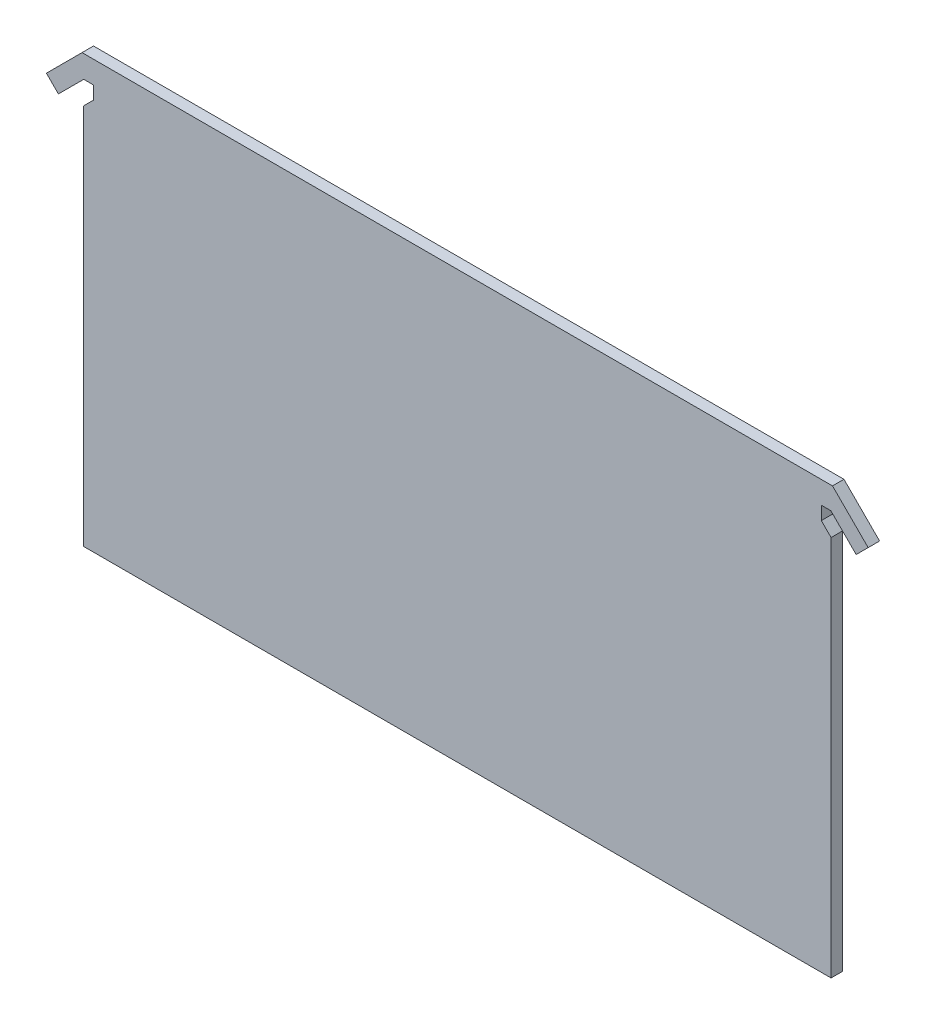
from build123d import *

# Parameters (mm, degrees)
BOSS_EXTRUDE1_DEPTH = 6


with BuildPart() as part:
    # Sketch1 → Boss-Extrude1 (new body)
    with BuildSketch(Plane.XY):
        Polygon((163.741243393, 121.016675198), (-153.702428255, 121.016675198), (-191.706323206, 121.016675198), (-210.391169282, 102.331829122), (-204.103303895, 96.043963734), (-190.830592431, 109.316675198), (-185.830592431, 109.316675198), (-185.830592431, 102.316675198), (-190.955336293, 97.191931336), (-190.955336293, -102.795343439), (200.994151431, -102.795343439), (200.994151431, 97.191931336), (195.869407569, 102.316675198), (195.869407569, 109.316675198), (200.869407569, 109.316675198), (214.142119033, 96.043963734), (220.429984421, 102.331829122), (201.745138344, 121.016675198), align=None)
    extrude(amount=BOSS_EXTRUDE1_DEPTH)


solid = part.part
